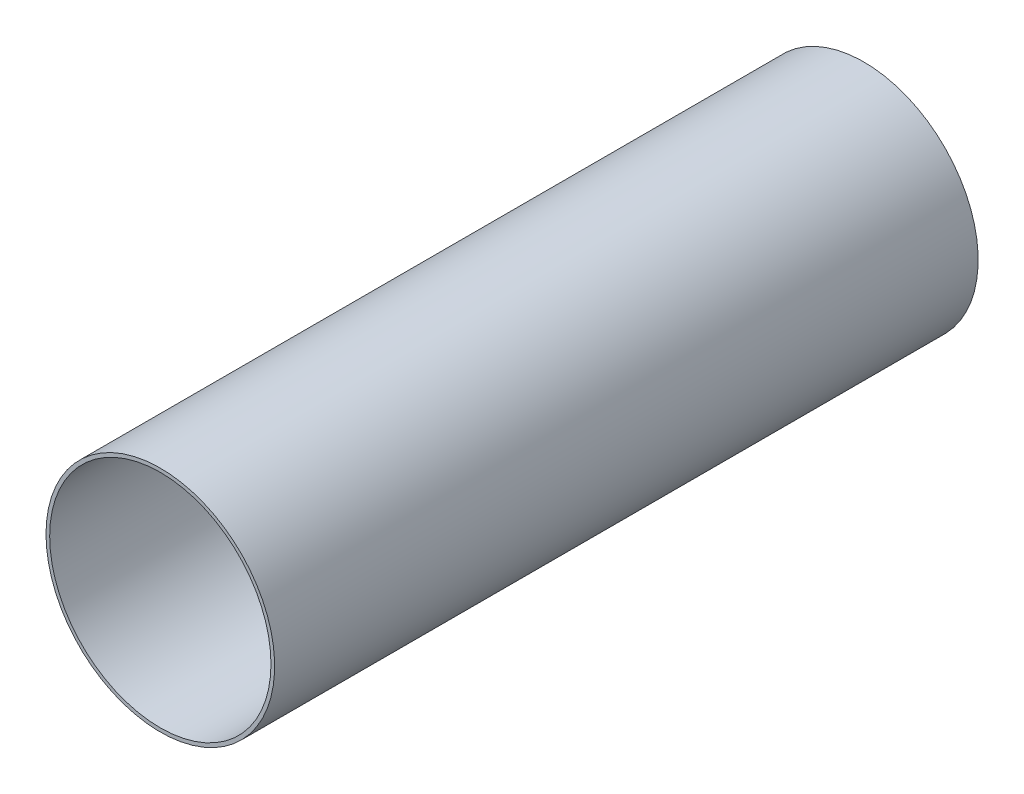
from build123d import *

# Parameters (mm, degrees)
SKETCH1_R           = 49.53
SKETCH1_R_2         = 47.9425
BOSS_EXTRUDE1_DEPTH = 304.8


with BuildPart() as part:
    # Sketch1 → Boss-Extrude1 (new body)
    with BuildSketch(Plane.XY):
        with Locations(Location((0, 0, 0), (0, 0, 180))):
            Circle(SKETCH1_R)
        with Locations(Location((0, 0, 0), (0, 0, 180))):
            Circle(SKETCH1_R_2, mode=Mode.SUBTRACT)
    extrude(amount=BOSS_EXTRUDE1_DEPTH)


solid = part.part
